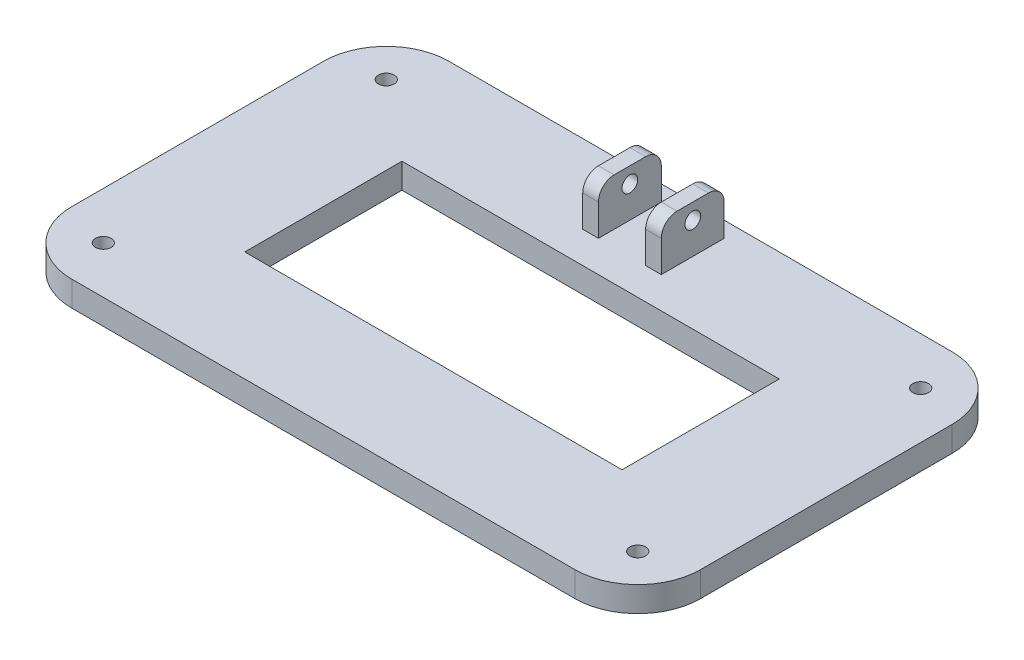
from build123d import *

# Parameters (mm, degrees)
SKETCH1_W               = 120
SKETCH1_H               = 50
BOSS_EXTRUDE1_DEPTH     = 8
SKETCH2_R               = 2.5
CUT_EXTRUDE1_DEPTH      = 10
MIRROR2_COPY_1_SKETCH_R = 2.5
MIRROR2_COPY_1_DEPTH    = 10
SKETCH4_W               = 5
SKETCH4_H               = 20
BOSS_EXTRUDE2_DEPTH     = 15
FILLET1_R               = 5
FILLET1_OF_MIRROR4_R    = 5
SKETCH5_R               = 2.5
CUT_EXTRUDE2_DEPTH      = 54


with BuildPart() as part:
    # Sketch1 → Boss-Extrude1 (new body)
    with BuildSketch(Plane(origin=(0, 0, 0), x_dir=(1, 0, 0), z_dir=(0, 1, 0))):
        with BuildLine():
            Line((-80, 60), (80, 60))
            ThreePointArc((80, 60), (94.142135624, 54.142135624), (100, 40))
            Line((100, 40), (100, -40))
            ThreePointArc((100, -40), (94.142135624, -54.142135624), (80, -60))
            Line((80, -60), (-80, -60))
            ThreePointArc((-80, -60), (-94.142135624, -54.142135624), (-100, -40))
            Line((-100, -40), (-100, 40))
            ThreePointArc((-100, 40), (-94.142135624, 54.142135624), (-80, 60))
        make_face()
        Rectangle(SKETCH1_W, SKETCH1_H, mode=Mode.SUBTRACT)
    extrude(amount=BOSS_EXTRUDE1_DEPTH)

    # Sketch2 → Cut-Extrude1 (cut)
    with BuildSketch(Plane(origin=(0, 8, 0), x_dir=(1, 0, 0), z_dir=(0, 1, 0))):
        with Locations(Location((85, -45, 0), (0, 0, 270))):
            Circle(SKETCH2_R)
    cut_extrude1 = extrude(amount=-CUT_EXTRUDE1_DEPTH, mode=Mode.SUBTRACT)

    # Mirror1: Cut-Extrude1 across plane
    add(cut_extrude1.mirror(Plane(origin=(0, 0, 0), x_dir=(0, 0, 1), z_dir=(1, 0, 0))), mode=Mode.SUBTRACT)

    # Mirror2: Cut-Extrude1 across plane
    add(cut_extrude1.mirror(Plane.XY), mode=Mode.SUBTRACT)

    # Mirror2 copy 1 sketch → Mirror2 copy 1 (cut)
    with BuildSketch(Plane(origin=(0, 8, 0), x_dir=(-1, 0, 0), z_dir=(0, 1, 0))):
        with Locations(Location((85, -45, 0), (0, 0, 270))):
            Circle(MIRROR2_COPY_1_SKETCH_R)
    extrude(amount=-MIRROR2_COPY_1_DEPTH, mode=Mode.SUBTRACT)

    # Sketch4 → Boss-Extrude2 (add)
    with BuildSketch(Plane(origin=(0, 8, 0), x_dir=(1, 0, 0), z_dir=(0, 1, 0))):
        with Locations((10, 45)):
            Rectangle(SKETCH4_W, SKETCH4_H)
    boss_extrude2 = extrude(amount=BOSS_EXTRUDE2_DEPTH)

    # Fillet1
    fillet1_edges = [part.edges().sort_by_distance(p)[0] for p in [
        (10, 23, -55),
        (10, 23, -35),
    ]]
    fillet(fillet1_edges, radius=FILLET1_R)

    # Mirror4: Boss-Extrude2 across plane
    add(boss_extrude2.mirror(Plane(origin=(0, 0, 0), x_dir=(0, 0, 1), z_dir=(1, 0, 0))))

    # Fillet1 of Mirror4
    fillet1_of_mirror4_edges = [part.edges().sort_by_distance(p)[0] for p in [
        (-10, 23, -55),
        (-10, 23, -35),
    ]]
    fillet(fillet1_of_mirror4_edges, radius=FILLET1_OF_MIRROR4_R)

    # Sketch5 → Cut-Extrude2 (cut)
    with BuildSketch(Plane(origin=(12.5, 0, 0), x_dir=(0, 0, -1), z_dir=(1, 0, 0))):
        with Locations((45, 18)):
            Circle(SKETCH5_R)
    extrude(amount=-CUT_EXTRUDE2_DEPTH, mode=Mode.SUBTRACT)


solid = part.part
